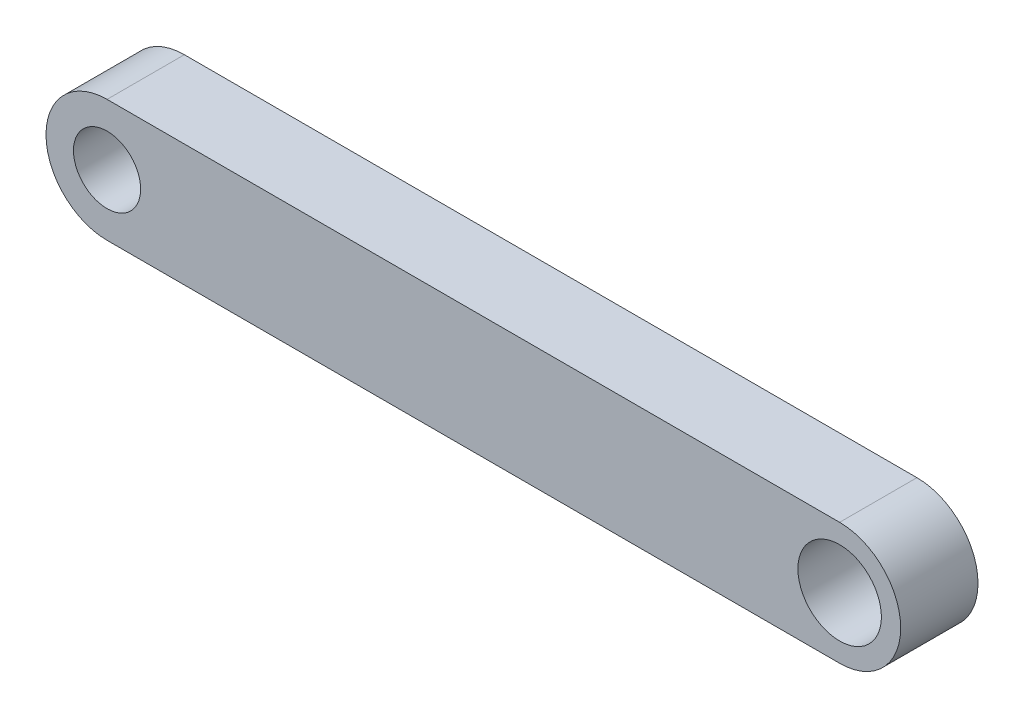
from build123d import *

# Parameters (mm, degrees)
SKETCH1_R           = 2.05
SKETCH1_R_2         = 1.65
BOSS_EXTRUDE1_DEPTH = 3.8


with BuildPart() as part:
    # Sketch1 → Boss-Extrude1 (new body)
    with BuildSketch(Plane.XY):
        with BuildLine():
            Line((0, 3), (-36, 3))
            ThreePointArc((-36, 3), (-39, 0), (-36, -3))
            Line((-36, -3), (0, -3))
            ThreePointArc((0, -3), (3, 0), (0, 3))
        make_face()
        with Locations(Location((0, 0, 0), (0, 0, 180))):
            Circle(SKETCH1_R, mode=Mode.SUBTRACT)
        with Locations(Location((-36, 0, 0), (0, 0, 180))):
            Circle(SKETCH1_R_2, mode=Mode.SUBTRACT)
    extrude(amount=BOSS_EXTRUDE1_DEPTH)


solid = part.part
